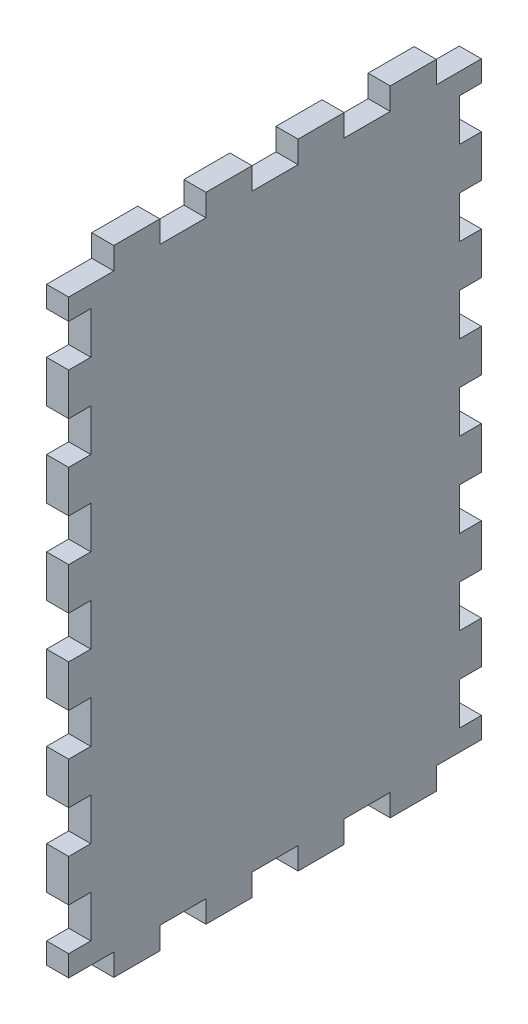
from build123d import *

# Parameters (mm, degrees)
SCHIZZO1_W                   = 50
SCHIZZO1_H                   = 80
ESTRUSIONE_ESTRUSIONE1_DEPTH = 3
SCHIZZO2_W                   = 3
SCHIZZO2_H                   = 2.857142857
ESTRUSIONE_ESTRUSIONE2_DEPTH = 3
SCHIZZO3_W                   = 3
SCHIZZO3_H                   = 5.714285715
ESTRUSIONE_ESTRUSIONE3_DEPTH = 3
RIPETIZIONE_A_L1_COUNT       = 6
RIPETIZIONE_A_L1_PITCH       = 11.428571
SCHIZZO4_W                   = 6.25
SCHIZZO4_H                   = 3
ESTRUSIONE_ESTRUSIONE4_DEPTH = 3
RIPETIZIONE_A_L2_COUNT       = 4
RIPETIZIONE_A_L2_PITCH       = 12.5


with BuildPart() as part:
    # Schizzo1 → Estrusione-Estrusione1 (new body)
    with BuildSketch(Plane(origin=(0, 0, 0), x_dir=(0, 0, -1), z_dir=(1, 0, 0))):
        with Locations((25, 40)):
            Rectangle(SCHIZZO1_W, SCHIZZO1_H)
    extrude(amount=ESTRUSIONE_ESTRUSIONE1_DEPTH)

    # Schizzo2 → Estrusione-Estrusione2 (add)
    with BuildSketch(Plane(origin=(3, 0, 0), x_dir=(0, 0, -1), z_dir=(1, 0, 0))):
        with Locations((-1.5, 78.571428572)):
            Rectangle(SCHIZZO2_W, SCHIZZO2_H)
        with Locations((51.5, 78.571428572)):
            Rectangle(SCHIZZO2_W, SCHIZZO2_H)
        with Locations((51.5, 1.428571429)):
            Rectangle(SCHIZZO2_W, SCHIZZO2_H)
        with Locations((-1.5, 1.428571429)):
            Rectangle(SCHIZZO2_W, SCHIZZO2_H)
    extrude(amount=-ESTRUSIONE_ESTRUSIONE2_DEPTH)

    # Schizzo3 → Estrusione-Estrusione3 (add)
    with BuildSketch(Plane(origin=(3, 0, 0), x_dir=(0, 0, -1), z_dir=(1, 0, 0))):
        with Locations((-1.5, 68.571428572)):
            Rectangle(SCHIZZO3_W, SCHIZZO3_H)
        with Locations((51.5, 68.571428572)):
            Rectangle(SCHIZZO3_W, SCHIZZO3_H)
    estrusione_estrusione3 = extrude(amount=-ESTRUSIONE_ESTRUSIONE3_DEPTH)

    # Ripetizione a L1: Estrusione-Estrusione3 ×6
    with Locations(*[(0, -i * RIPETIZIONE_A_L1_PITCH, 0) for i in range(1, RIPETIZIONE_A_L1_COUNT)]):
        add(estrusione_estrusione3)

    # Schizzo4 → Estrusione-Estrusione4 (add)
    with BuildSketch(Plane(origin=(3, 0, 0), x_dir=(0, 0, -1), z_dir=(1, 0, 0))):
        with Locations((6.25, 81.5)):
            Rectangle(SCHIZZO4_W, SCHIZZO4_H)
        with Locations((6.25, -1.5)):
            Rectangle(SCHIZZO4_W, SCHIZZO4_H)
    estrusione_estrusione4 = extrude(amount=-ESTRUSIONE_ESTRUSIONE4_DEPTH)

    # Ripetizione a L2: Estrusione-Estrusione4 ×4
    with Locations(*[(0, 0, -i * RIPETIZIONE_A_L2_PITCH) for i in range(1, RIPETIZIONE_A_L2_COUNT)]):
        add(estrusione_estrusione4)


solid = part.part
